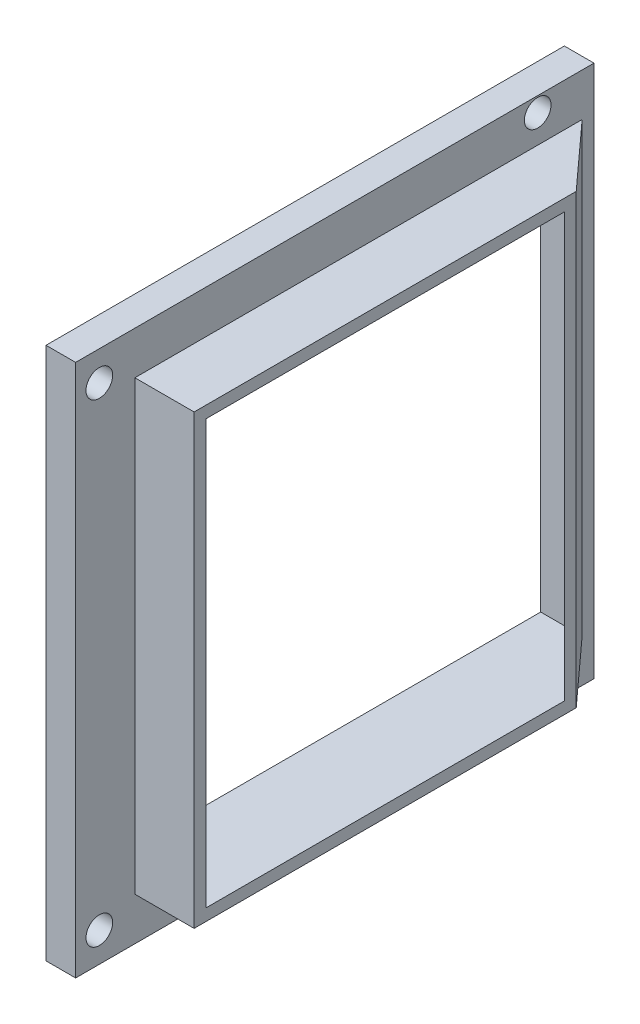
from build123d import *

# Parameters (mm, degrees)
SKETCH1_W                     = 87.5
SKETCH1_H                     = 90
SKETCH1_W_2                   = 71.5
SKETCH1_H_2                   = 71.5
BOSS_EXTRUDE1_DEPTH           = 5
M4_CLEARANCE_HOLE1_AT_2_COUNT = 2
M4_CLEARANCE_HOLE1_AT_2_PITCH = 74.042217687
SKETCH5_W                     = 10
SKETCH5_H                     = 2
BOSS_EXTRUDE2_DEPTH           = 90
SKETCH6_W                     = 87.5
SKETCH6_H                     = 7.25
CUT_EXTRUDE1_DEPTH            = 10
BOSS_EXTRUDE3_DEPTH           = 2


with BuildPart() as part:
    # Sketch1 → Boss-Extrude1 (new body)
    with BuildSketch(Plane(origin=(0, 0, 0), x_dir=(0, 0, -1), z_dir=(1, 0, 0))):
        Rectangle(SKETCH1_W, SKETCH1_H)
        with Locations((4, 0)):
            Rectangle(SKETCH1_W_2, SKETCH1_H_2, mode=Mode.SUBTRACT)
    extrude(amount=BOSS_EXTRUDE1_DEPTH)

    # Sketch4 → M4 Clearance Hole1 (revolve, cut)
    with BuildSketch(Plane(origin=(5, 40, 39.75), x_dir=(0, 0, -1), z_dir=(0, 1, 0))):
        Polygon((0, 0), (0, 9.151936393), (2.25, 7.8), (2.25, 0), align=None)
    m4_clearance_hole1 = revolve(axis=Axis((11.35, 40, 39.75), (-1, 0, 0)), mode=Mode.SUBTRACT)

    # M4 Clearance Hole1 at 2: M4 Clearance Hole1 ×2
    with Locations(*[Vector(0, 0.0337645208112264, -0.9994298160123043) * (i * M4_CLEARANCE_HOLE1_AT_2_PITCH) for i in range(1, M4_CLEARANCE_HOLE1_AT_2_COUNT)]):
        add(m4_clearance_hole1, mode=Mode.SUBTRACT)

    # Mirror1: M4 Clearance Hole1 across plane
    add(m4_clearance_hole1.mirror(Plane.ZX), mode=Mode.SUBTRACT)

    # Mirror1 copy 1 sketch → Mirror1 copy 1 (revolve, cut)
    with BuildSketch(Plane(origin=(5, -42.5, -34.25), x_dir=(0, 0, -1), z_dir=(0, -1, 0))):
        Polygon((0, 0), (0, -9.151936393), (2.25, -7.8), (2.25, 0), align=None)
    revolve(axis=Axis((11.35, -42.5, -34.25), (1, 0, 0)), mode=Mode.SUBTRACT)

    # Sketch5 → Boss-Extrude2 (add)
    with BuildSketch(Plane(origin=(0, 45, 0), x_dir=(1, 0, 0), z_dir=(0, 1, 0))):
        with Locations((10, -32.75)):
            Rectangle(SKETCH5_W, SKETCH5_H)
        Polygon((5, 41.75), (5, 39.75), (15, 28.75), (15, 30.75), align=None)
    extrude(amount=-BOSS_EXTRUDE2_DEPTH)

    # Sketch6 → Cut-Extrude1 (cut)
    with BuildSketch(Plane(origin=(5, 0, 0), x_dir=(0, 0, -1), z_dir=(1, 0, 0))):
        with Locations((0, 41.375)):
            Rectangle(SKETCH6_W, SKETCH6_H)
    cut_extrude1 = extrude(amount=CUT_EXTRUDE1_DEPTH, mode=Mode.SUBTRACT)

    # Sketch8 → Boss-Extrude3 (add)
    with BuildSketch(Plane(origin=(0, 37.75, 0), x_dir=(1, 0, 0), z_dir=(0, 1, 0))):
        Polygon((15, 28.75), (15, -31.75), (5, -31.75), (5, 39.75), align=None)
    boss_extrude3 = extrude(amount=-BOSS_EXTRUDE3_DEPTH)

    # Mirror7: Cut-Extrude1, Boss-Extrude3 across plane
    add(cut_extrude1.mirror(Plane.ZX), mode=Mode.SUBTRACT)
    add(boss_extrude3.mirror(Plane.ZX))


solid = part.part
